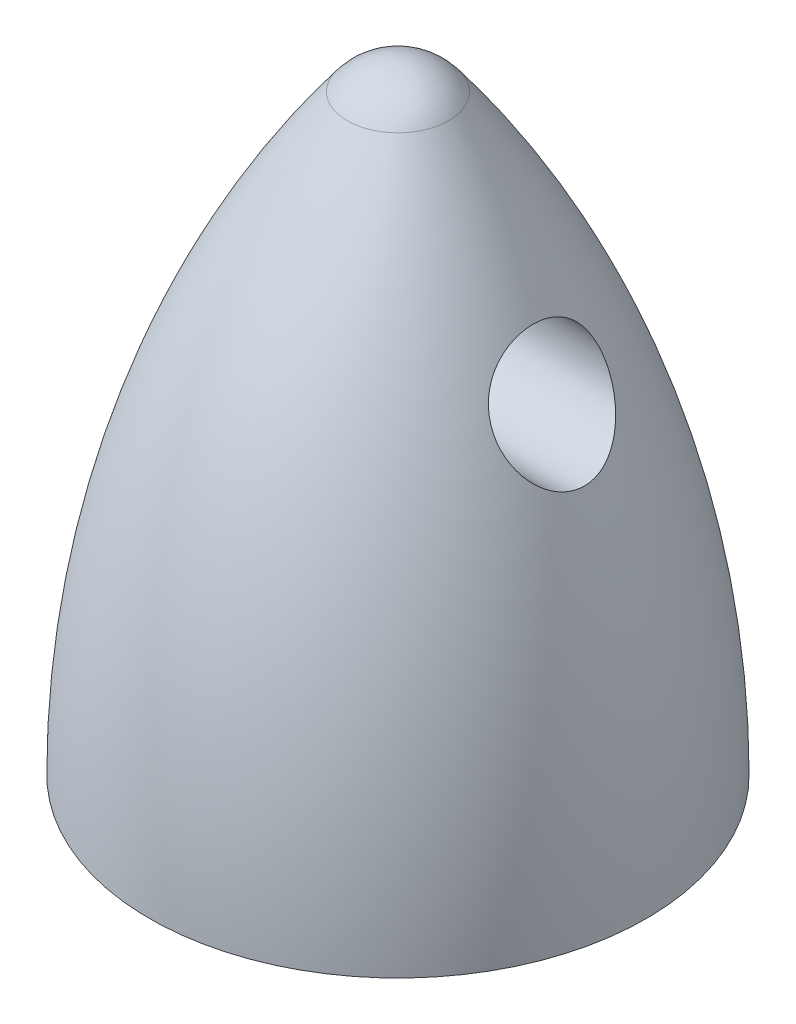
from build123d import *

# Parameters (mm, degrees)
SKETCH2_R               = 5.282935157
CUT_EXTRUDE1_DEPTH      = 3.8
CUT_EXTRUDE2_DEPTH      = 19.600984372
CUT_EXTRUDE2_DEPTH_BACK = 19.600984372
SKETCH3_R               = 1.5


with BuildPart() as part:
    # Sketch1 → Revolve1 (revolve)
    with BuildSketch(Plane(origin=(0, 0, 0), x_dir=(0, 0, -1), z_dir=(1, 0, 0))):
        with BuildLine():
            Line((0, 0), (6.5, 0))
            ThreePointArc((6.5, 0), (5.172084989, 8.171560643), (1.324999798, 15.502160698))
            ThreePointArc((1.324999798, 15.502160698), (0.740614183, 15.991289723), (0, 16.170856928))
            Line((0, 16.170856928), (0, 0))
        make_face()
    revolve(axis=Axis((0, 0, 0), (0, 1, 0)))

    # Sketch2 → Cut-Extrude1 (cut)
    with BuildSketch(Plane.XZ):
        with Locations(Location((0, 0, 0), (0, 0, 270))):
            Circle(SKETCH2_R)
    extrude(amount=-CUT_EXTRUDE1_DEPTH, mode=Mode.SUBTRACT)

    # Sketch3 → Cut-Extrude2 (cut, two sides: drawn at the far end of the back side and taken through both)
    with BuildSketch(Plane(origin=(0, 0, 0), x_dir=(0, 0, -1), z_dir=(1, 0, 0)).offset(-CUT_EXTRUDE2_DEPTH_BACK)):
        with Locations(Location((0, 10.5, 0), (0, 0, 49.923498867))):
            Circle(SKETCH3_R)
    extrude(amount=CUT_EXTRUDE2_DEPTH + CUT_EXTRUDE2_DEPTH_BACK, mode=Mode.SUBTRACT)


solid = part.part
